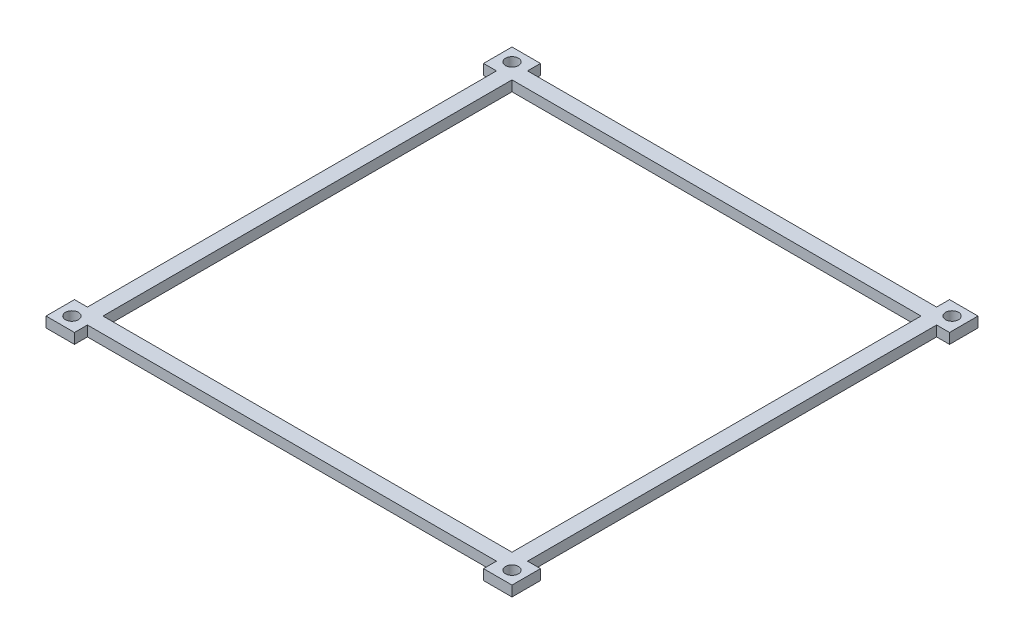
from build123d import *

# Parameters (mm, degrees)
CROQUIS1_W              = 200
CROQUIS1_H              = 200
CROQUIS1_R              = 2.5
SALIENTE_EXTRUIR1_DEPTH = 4
CROQUIS2_W              = 158
CROQUIS2_H              = 158
CORTAR_EXTRUIR1_DEPTH   = 10
CROQUIS3_W              = 200
CROQUIS3_H              = 200
CROQUIS3_W_2            = 180
CROQUIS3_H_2            = 180
CORTAR_EXTRUIR2_DEPTH   = 10
CROQUIS4_W              = 158
CROQUIS4_H              = 5
CROQUIS4_W_2            = 5
CROQUIS4_H_2            = 158
CORTAR_EXTRUIR3_DEPTH   = 10


with BuildPart() as part:
    # Croquis1 → Saliente-Extruir1 (new body)
    with BuildSketch(Plane(origin=(0, 0, 0), x_dir=(1, 0, 0), z_dir=(0, 1, 0))):
        with Locations((100, 100)):
            Rectangle(CROQUIS1_W, CROQUIS1_H)
        with Locations(Location((15, 185, 0), (0, 0, 270))):
            Circle(CROQUIS1_R, mode=Mode.SUBTRACT)
        with Locations(Location((185, 185, 0), (0, 0, 270))):
            Circle(CROQUIS1_R, mode=Mode.SUBTRACT)
        with Locations(Location((185, 15, 0), (0, 0, 270))):
            Circle(CROQUIS1_R, mode=Mode.SUBTRACT)
        with Locations(Location((15, 15, 0), (0, 0, 270))):
            Circle(CROQUIS1_R, mode=Mode.SUBTRACT)
    extrude(amount=SALIENTE_EXTRUIR1_DEPTH)

    # Croquis2 → Cortar-Extruir1 (cut)
    with BuildSketch(Plane(origin=(0, 4, 0), x_dir=(1, 0, 0), z_dir=(0, 1, 0))):
        with Locations((100, 100)):
            Rectangle(CROQUIS2_W, CROQUIS2_H)
    extrude(amount=-CORTAR_EXTRUIR1_DEPTH, mode=Mode.SUBTRACT)

    # Croquis3 → Cortar-Extruir2 (cut)
    with BuildSketch(Plane(origin=(0, 4, 0), x_dir=(1, 0, 0), z_dir=(0, 1, 0))):
        with Locations((100, 100)):
            Rectangle(CROQUIS3_W, CROQUIS3_H)
        with Locations((100, 100)):
            Rectangle(CROQUIS3_W_2, CROQUIS3_H_2, mode=Mode.SUBTRACT)
    extrude(amount=-CORTAR_EXTRUIR2_DEPTH, mode=Mode.SUBTRACT)

    # Croquis4 → Cortar-Extruir3 (cut)
    with BuildSketch(Plane(origin=(0, 4, 0), x_dir=(1, 0, 0), z_dir=(0, 1, 0))):
        with Locations((100, 187.5)):
            Rectangle(CROQUIS4_W, CROQUIS4_H)
        with Locations((187.5, 100)):
            Rectangle(CROQUIS4_W_2, CROQUIS4_H_2)
        with Locations((100, 12.5)):
            Rectangle(CROQUIS4_W, CROQUIS4_H)
        with Locations((12.5, 100)):
            Rectangle(CROQUIS4_W_2, CROQUIS4_H_2)
    extrude(amount=-CORTAR_EXTRUIR3_DEPTH, mode=Mode.SUBTRACT)


solid = part.part
